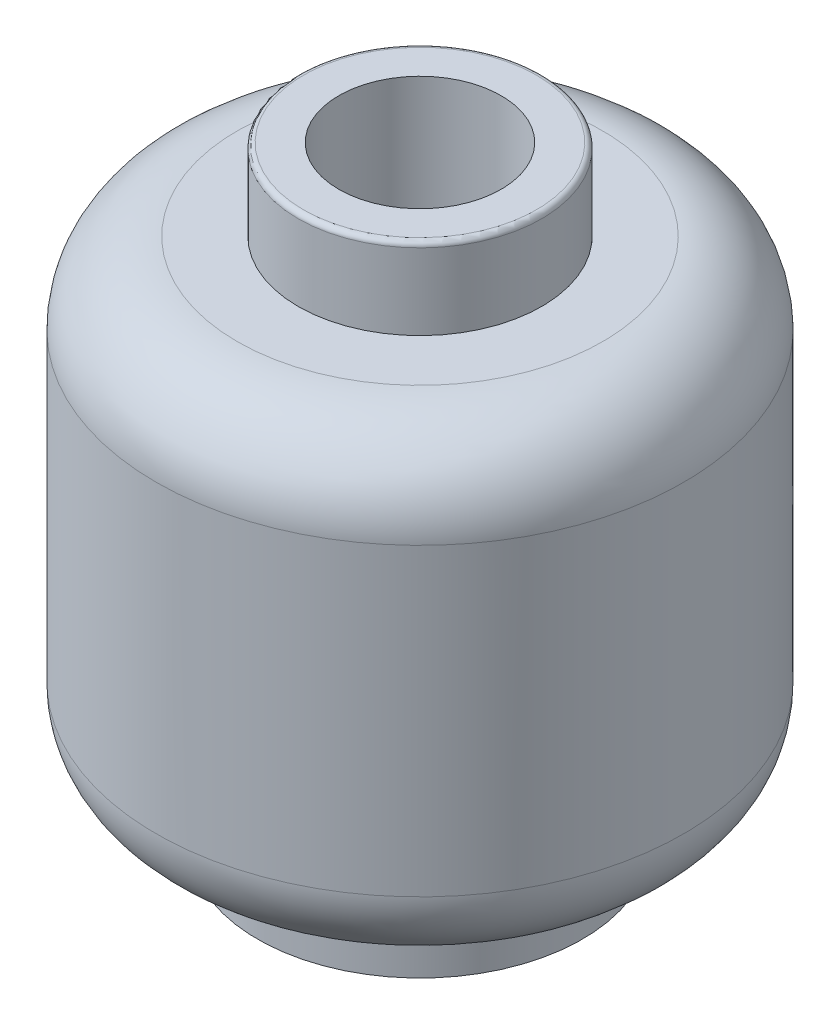
from build123d import *

# Parameters (mm, degrees)
SKETCH2_R           = 5.159375
BOSS_EXTRUDE2_DEPTH = 11.90625
CUT_EXTRUDE1_START  = -1.5875
SKETCH3_R           = 5.159375
SKETCH3_R_2         = 2.38125
CUT_EXTRUDE1_DEPTH  = 1.5875
SKETCH4_R           = 5.159375
SKETCH4_R_2         = 3.175
CUT_EXTRUDE2_DEPTH  = 1.190625
SKETCH5_R           = 2.38125
CUT_EXTRUDE3_DEPTH  = 8.73125
SKETCH6_R           = 1.5875
CUT_EXTRUDE4_DEPTH  = 2.38125
FILLET1_R           = 1.5875
FILLET3_R           = 0.1016


with BuildPart() as part:
    # Sketch2 → Boss-Extrude2 (new body)
    with BuildSketch(Plane(origin=(0, 0, 0), x_dir=(1, 0, 0), z_dir=(0, 1, 0))):
        with Locations(Location((5.159375, 5.159375, 0), (0, 0, 270))):
            Circle(SKETCH2_R)
    extrude(amount=BOSS_EXTRUDE2_DEPTH)

    # Sketch3 → Cut-Extrude1 (cut)
    with BuildSketch(Plane(origin=(0, 11.90625, 0), x_dir=(1, 0, 0), z_dir=(0, 1, 0)).offset(CUT_EXTRUDE1_START)):
        with Locations(Location((5.159375, 5.159375, 0), (0, 0, 270))):
            Circle(SKETCH3_R)
        with Locations(Location((5.159375, 5.159375, 0), (0, 0, 270))):
            Circle(SKETCH3_R_2, mode=Mode.SUBTRACT)
    extrude(amount=CUT_EXTRUDE1_DEPTH, mode=Mode.SUBTRACT)

    # Sketch4 → Cut-Extrude2 (cut)
    with BuildSketch(Plane.XZ):
        with Locations(Location((5.159375, -5.159375, 0), (0, 0, 270))):
            Circle(SKETCH4_R)
        with Locations(Location((5.159375, -5.159375, 0), (0, 0, 270))):
            Circle(SKETCH4_R_2, mode=Mode.SUBTRACT)
    extrude(amount=-CUT_EXTRUDE2_DEPTH, mode=Mode.SUBTRACT)

    # Sketch5 → Cut-Extrude3 (cut)
    with BuildSketch(Plane.XZ):
        with Locations(Location((5.159375, -5.159375, 0), (0, 0, 90))):
            Circle(SKETCH5_R)
    extrude(amount=-CUT_EXTRUDE3_DEPTH, mode=Mode.SUBTRACT)

    # Sketch6 → Cut-Extrude4 (cut)
    with BuildSketch(Plane(origin=(0, 11.90625, 0), x_dir=(1, 0, 0), z_dir=(0, 1, 0))):
        with Locations(Location((5.159375, 5.159375, 0), (0, 0, 270))):
            Circle(SKETCH6_R)
    extrude(amount=-CUT_EXTRUDE4_DEPTH, mode=Mode.SUBTRACT)

    # Fillet1
    fillet1_edges = [part.edges().sort_by_distance(p)[0] for p in [
        (5.159375, 1.190625, -10.31875),
        (5.159375, 10.31875, -10.31875),
    ]]
    fillet(fillet1_edges, radius=FILLET1_R)

    # Fillet3
    fillet3_edges = [part.edges().sort_by_distance(p)[0] for p in [
        (5.159375, 11.90625, -7.540625),
    ]]
    fillet(fillet3_edges, radius=FILLET3_R)


solid = part.part
